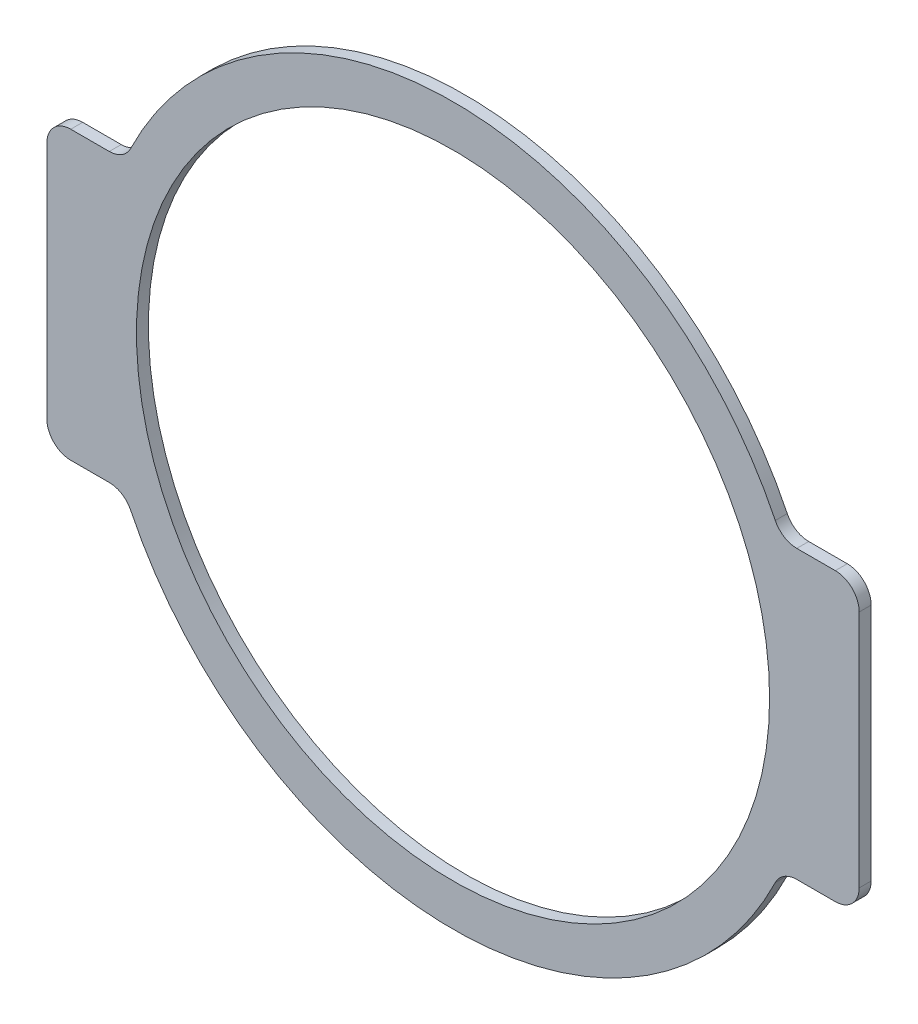
from build123d import *

# Parameters (mm, degrees)
EXTRUDE_2_DEPTH = 5


with BuildPart() as part:
    # 草图1 → 凸台-拉伸2 (new body)
    with BuildSketch(Plane.XY):
        with BuildLine():
            Line((-170, 50), (-170, -50))
            ThreePointArc((-170, -50), (-167.071067812, -57.071067812), (-160, -60))
            Line((-160, -60), (-143.874945699, -60))
            ThreePointArc((-143.874945699, -60), (-138.57164484, -61.522087521), (-134.882761593, -65.625))
            ThreePointArc((-134.882761593, -65.625), (-79.549512883, -127.168687184), (0, -150))
            ThreePointArc((0, -150), (79.549512883, -127.168687184), (134.882761593, -65.625))
            ThreePointArc((134.882761593, -65.625), (138.57164484, -61.522087521), (143.874945699, -60))
            Line((143.874945699, -60), (160, -60))
            ThreePointArc((160, -60), (167.071067812, -57.071067812), (170, -50))
            Line((170, -50), (170, 50))
            ThreePointArc((170, 50), (167.071067812, 57.071067812), (160, 60))
            Line((160, 60), (143.874945699, 60))
            ThreePointArc((143.874945699, 60), (138.57164484, 61.522087521), (134.882761593, 65.625))
            ThreePointArc((134.882761593, 65.625), (0, 150), (-134.882761593, 65.625))
            ThreePointArc((-134.882761593, 65.625), (-138.57164484, 61.522087521), (-143.874945699, 60))
            Line((-143.874945699, 60), (-160, 60))
            ThreePointArc((-160, 60), (-167.071067812, 57.071067812), (-170, 50))
        make_face()
        with BuildLine():
            ThreePointArc((0, -132.5), (132.5, 0), (0, 132.5))
            ThreePointArc((0, 132.5), (-132.5, 0), (0, -132.5))
        make_face(mode=Mode.SUBTRACT)
    extrude(amount=EXTRUDE_2_DEPTH)


solid = part.part
